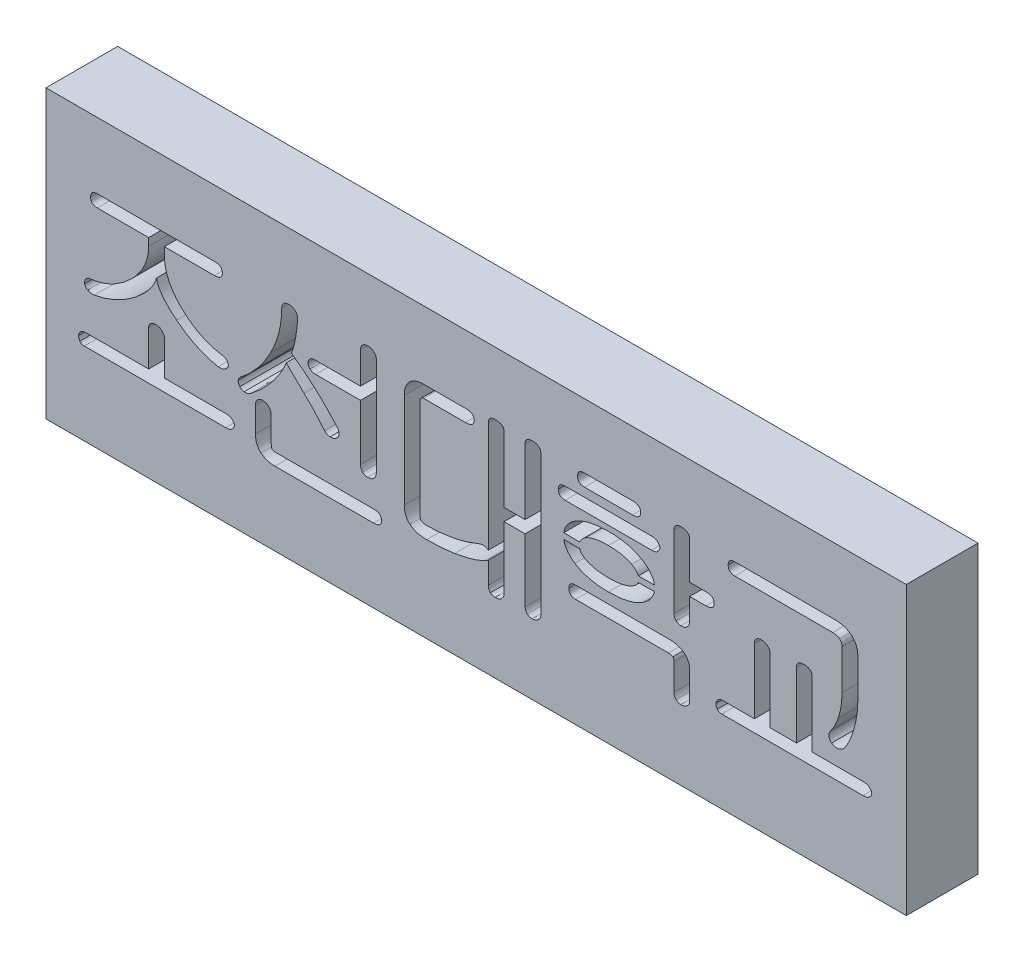
from build123d import *

# Parameters (mm, degrees)
SKETCH_1_W          = 60
SKETCH_1_H          = 20
EXTRUDE_1_DEPTH     = 5
CUT_EXTRUDE_1_DEPTH = 5
EXTRUDE_2_DEPTH     = 5


with BuildPart() as part:
    # 스케치1 → 보스-돌출1 (new body)
    with BuildSketch(Plane.XY):
        with Locations((30, -10)):
            Rectangle(SKETCH_1_W, SKETCH_1_H)
    extrude(amount=EXTRUDE_1_DEPTH)

    # 스케치2 → 컷-돌출1 (cut)
    # profile 1 of 14: a face of its own
    with BuildSketch(Plane.XY.offset(5)):
        with BuildLine():
            Line((11.743196013, -4.613258648), (3.588177984, -4.613258648))
            add(Edge.make_bspline(
                [(3.588177984, -4.613258648), (3.551138882, -4.613826649), (3.480826446, -4.614904904), (3.383328245, -4.636998521), (3.298127199, -4.667881596), (3.230315991, -4.717147552), (3.176232954, -4.777909236), (3.139896115, -4.853883321), (3.116844581, -4.942000588), (3.114368275, -5.005523138), (3.113072816, -5.038754441)],
                knots=[0, 0, 0, 0, 1.213778229, 2.304151591, 3.270502864, 4.169414572, 5.028575513, 5.916487207, 6.910027289, 8, 8, 8, 8], degree=3))
            add(Edge.make_bspline(
                [(3.113072816, -5.038754441), (3.112786656, -5.072624287), (3.112250556, -5.1360772), (3.134981766, -5.224533463), (3.168625743, -5.300844201), (3.21948276, -5.365097181), (3.289484028, -5.409925999), (3.371411055, -5.446211911), (3.469887047, -5.463004715), (3.539810119, -5.466317292), (3.576729667, -5.46806634)],
                knots=[0, 0, 0, 0, 1.111351727, 2.082043886, 2.98209018, 3.846045182, 4.735294455, 5.692779303, 6.781781998, 8, 8, 8, 8], degree=3))
            Line((3.576729667, -5.46806634), (7.158144931, -5.46806634))
            Line((7.158144931, -5.46806634), (7.158144931, -5.996596989))
            add(Edge.make_bspline(
                [(7.158144931, -5.996596989), (7.154282128, -6.110010454), (7.146575893, -6.336268604), (7.090153263, -6.672841822), (6.992772893, -7.002823588), (6.860969677, -7.327766974), (6.691340074, -7.647745156), (6.480857495, -7.959873996), (6.237816443, -8.271092652), (6.050196811, -8.46412458), (5.954163561, -8.562928119)],
                knots=[0, 0, 0, 0, 0.934621415, 1.864555616, 2.803577483, 3.76540004, 4.750360518, 5.782690533, 6.865068468, 8, 8, 8, 8], degree=3))
            add(Edge.make_bspline(
                [(5.954163561, -8.562928119), (5.852461416, -8.659805256), (5.652127798, -8.850634537), (5.332213368, -9.108030467), (4.998679363, -9.3304996), (4.657073789, -9.527388317), (4.302182471, -9.6897664), (3.937027685, -9.821212276), (3.560822425, -9.924890497), (3.30371968, -9.967012564), (3.174130508, -9.988243624)],
                knots=[0, 0, 0, 0, 1.059754881, 2.087512799, 3.093977114, 4.082890173, 5.060143393, 6.034941555, 7.00953879, 8, 8, 8, 8], degree=3))
            add(Edge.make_bspline(
                [(3.174130508, -9.988243624), (3.135157802, -9.989983572), (3.059884116, -9.993344189), (2.953267228, -10.02167216), (2.85925295, -10.072699692), (2.80990483, -10.121747266), (2.78488772, -10.146612013)],
                knots=[0, 0, 0, 0, 1.077771385, 2.081657489, 3.027493121, 4, 4, 4, 4], degree=3))
            add(Edge.make_bspline(
                [(2.78488772, -10.146612013), (2.767832453, -10.171431254), (2.734188211, -10.220391176), (2.704157484, -10.304119267), (2.689525737, -10.392349077), (2.694542093, -10.451872434), (2.697117287, -10.482429321)],
                knots=[0, 0, 0, 0, 1.010965901, 1.994291963, 2.970350526, 4, 4, 4, 4], degree=3))
            add(Edge.make_bspline(
                [(2.697117287, -10.482429321), (2.704675737, -10.510960748), (2.719645856, -10.567469541), (2.765953461, -10.642739553), (2.825937143, -10.710131667), (2.876833301, -10.74364965), (2.903186998, -10.761005042)],
                knots=[0, 0, 0, 0, 0.988368707, 1.957543962, 2.942429626, 4, 4, 4, 4], degree=3))
            add(Edge.make_bspline(
                [(2.903186998, -10.761005042), (2.932518346, -10.777078761), (2.994750755, -10.81118242), (3.106867564, -10.834604427), (3.235036724, -10.847296846), (3.326124823, -10.839537767), (3.374476061, -10.835419105)],
                knots=[0, 0, 0, 0, 0.822755861, 1.7456436, 2.803346158, 4, 4, 4, 4], degree=3))
            add(Edge.make_bspline(
                [(3.374476061, -10.835419105), (3.503326636, -10.809702635), (3.760385757, -10.758397836), (4.139567253, -10.652118912), (4.512352584, -10.522130551), (4.878547799, -10.368027446), (5.236933178, -10.187361674), (5.587720992, -9.982136408), (5.934643601, -9.756357965), (6.155565967, -9.58711927), (6.267084234, -9.501690138)],
                knots=[0, 0, 0, 0, 0.979673969, 1.954466462, 2.934094494, 3.922594533, 4.915410195, 5.925081107, 6.952612347, 8, 8, 8, 8], degree=3))
            add(Edge.make_bspline(
                [(6.267084234, -9.501690138), (6.365791959, -9.419898055), (6.555995838, -9.262289606), (6.819146389, -9.01970437), (7.047901458, -8.779449503), (7.245579813, -8.545344416), (7.410333996, -8.315964213), (7.538199268, -8.088852982), (7.640066279, -7.867842956), (7.679198511, -7.716459626), (7.698123897, -7.643246629)],
                knots=[0, 0, 0, 0, 1.288869495, 2.483574379, 3.596355165, 4.622356127, 5.562812011, 6.430618007, 7.241005209, 8, 8, 8, 8], degree=3))
            add(Edge.make_bspline(
                [(7.698123897, -7.643246629), (7.717222188, -7.717012302), (7.756631137, -7.869226326), (7.855119149, -8.092758832), (7.983867947, -8.318874313), (8.146364338, -8.546414116), (8.339502384, -8.777432124), (8.566626163, -9.009900702), (8.82387365, -9.247136731), (9.012448853, -9.398511613), (9.110083032, -9.476885451)],
                knots=[0, 0, 0, 0, 0.774578378, 1.598327329, 2.476838199, 3.419871113, 4.440289186, 5.539146788, 6.725901499, 8, 8, 8, 8], degree=3))
            add(Edge.make_bspline(
                [(9.110083032, -9.476885451), (9.224205262, -9.565375502), (9.449178263, -9.739818926), (9.799756311, -9.974883184), (10.155543541, -10.183438652), (10.516778597, -10.367023544), (10.882868957, -10.526049138), (11.254789317, -10.657501341), (11.630333233, -10.766425287), (11.885227822, -10.816295137), (12.01223147, -10.841143263)],
                knots=[0, 0, 0, 0, 1.06929483, 2.107936973, 3.123452199, 4.122001319, 5.107307742, 6.077225608, 7.041959409, 8, 8, 8, 8], degree=3))
            add(Edge.make_bspline(
                [(12.01223147, -10.841143263), (12.057395748, -10.843536253), (12.143433792, -10.848094903), (12.266226238, -10.837173926), (12.376391072, -10.809885071), (12.439544766, -10.775680642), (12.470164162, -10.759096989)],
                knots=[0, 0, 0, 0, 1.146332821, 2.183766394, 3.119418496, 4, 4, 4, 4], degree=3))
            add(Edge.make_bspline(
                [(12.470164162, -10.759096989), (12.502613905, -10.73634069), (12.562371479, -10.694434003), (12.636135169, -10.625320408), (12.690471163, -10.556788431), (12.705520331, -10.50595916), (12.712486878, -10.482429321)],
                knots=[0, 0, 0, 0, 1.261505007, 2.323114749, 3.223737823, 4, 4, 4, 4], degree=3))
            add(Edge.make_bspline(
                [(12.712486878, -10.482429321), (12.715805619, -10.457600242), (12.722751928, -10.40563159), (12.704556733, -10.324576054), (12.669383004, -10.240786843), (12.634001022, -10.188034863), (12.615176181, -10.159968383)],
                knots=[0, 0, 0, 0, 0.862110841, 1.804446199, 2.831864397, 4, 4, 4, 4], degree=3))
            add(Edge.make_bspline(
                [(12.615176181, -10.159968383), (12.593194347, -10.138392994), (12.545897178, -10.09197035), (12.448903943, -10.044382532), (12.329759124, -10.008017184), (12.241487141, -9.995207719), (12.193496494, -9.988243624)],
                knots=[0, 0, 0, 0, 0.790760166, 1.701437526, 2.750345271, 4, 4, 4, 4], degree=3))
            add(Edge.make_bspline(
                [(12.193496494, -9.988243624), (12.065142586, -9.965063064), (11.80912268, -9.91882618), (11.434682522, -9.809117526), (11.068473067, -9.67518698), (10.715400697, -9.505392747), (10.371836434, -9.308290116), (10.039496955, -9.079752112), (9.715456479, -8.82288546), (9.513759283, -8.630091649), (9.411555388, -8.532399273)],
                knots=[0, 0, 0, 0, 0.97985952, 1.954467509, 2.928723608, 3.908209786, 4.895610686, 5.903484976, 6.937655033, 8, 8, 8, 8], degree=3))
            add(Edge.make_bspline(
                [(9.411555388, -8.532399273), (9.319599386, -8.437199793), (9.140168225, -8.251439725), (8.903941095, -7.953570235), (8.703772184, -7.647344775), (8.541507194, -7.331837143), (8.413213978, -7.008772518), (8.32474778, -6.676978986), (8.265844248, -6.337690785), (8.260080275, -6.108146311), (8.257183393, -5.992780883)],
                knots=[0, 0, 0, 0, 1.107410592, 2.160859144, 3.176806917, 4.164950092, 5.125900117, 6.080309467, 7.035193855, 8, 8, 8, 8], degree=3))
            Line((8.257183393, -5.992780883), (8.257183393, -5.46806634))
            Line((8.257183393, -5.46806634), (11.743196013, -5.46806634))
            add(Edge.make_bspline(
                [(11.743196013, -5.46806634), (11.787132688, -5.466438088), (11.869110346, -5.463400073), (11.984705713, -5.445512046), (12.081953804, -5.411268963), (12.1644099, -5.365504966), (12.226174474, -5.302526506), (12.272867982, -5.227465463), (12.296219386, -5.137375125), (12.300184828, -5.073839583), (12.302255508, -5.040662494)],
                knots=[0, 0, 0, 0, 1.31566758, 2.454790823, 3.484303, 4.388648397, 5.250105247, 6.095641232, 7.005578923, 8, 8, 8, 8], degree=3))
            add(Edge.make_bspline(
                [(12.302255508, -5.040662494), (12.300365677, -5.006785237), (12.29681304, -4.943100405), (12.271785396, -4.853194669), (12.227562475, -4.77695399), (12.163005454, -4.716418062), (12.083136273, -4.666958658), (11.983897125, -4.637340183), (11.869528092, -4.614563116), (11.78722972, -4.613713327), (11.743196013, -4.613258648)],
                knots=[0, 0, 0, 0, 1.01215748, 1.902724232, 2.7635695, 3.61065729, 4.523672089, 5.545780795, 6.686871112, 8, 8, 8, 8], degree=3))
        make_face()
    # profile 2 of 14: a face of its own
    with BuildSketch(Plane.XY.offset(5)):
        with BuildLine():
            Line((7.158144931, -10.923189537), (7.158144931, -13.40556634))
            Line((7.158144931, -13.40556634), (2.771531349, -13.40556634))
            add(Edge.make_bspline(
                [(2.771531349, -13.40556634), (2.736387431, -13.406865969), (2.668473797, -13.409377428), (2.57266293, -13.433230005), (2.484606904, -13.469056544), (2.435626939, -13.506751188), (2.410909354, -13.525773672)],
                knots=[0, 0, 0, 0, 1.084904766, 2.096517139, 3.039413381, 4, 4, 4, 4], degree=3))
            add(Edge.make_bspline(
                [(2.410909354, -13.525773672), (2.375671901, -13.569003598), (2.306433193, -13.653946861), (2.284366099, -13.761213778), (2.273529546, -13.813889658)],
                knots=[0, 0, 0, 0, 1.017854134, 2, 2, 2, 2], degree=3))
            add(Edge.make_bspline(
                [(2.273529546, -13.813889658), (2.272357202, -13.841321324), (2.270045959, -13.895402024), (2.287002961, -13.974696165), (2.314947937, -14.051163941), (2.345635861, -14.096193541), (2.361299979, -14.119178119)],
                knots=[0, 0, 0, 0, 1.011024851, 1.993204861, 2.975666257, 4, 4, 4, 4], degree=3))
            add(Edge.make_bspline(
                [(2.361299979, -14.119178119), (2.380673388, -14.140677126), (2.419062158, -14.18327781), (2.494160241, -14.227047413), (2.579351683, -14.255494906), (2.640256503, -14.258691543), (2.672312599, -14.260374033)],
                knots=[0, 0, 0, 0, 0.977719996, 1.937370429, 2.914374059, 4, 4, 4, 4], degree=3))
            Line((2.672312599, -14.260374033), (12.533129907, -14.260374033))
            add(Edge.make_bspline(
                [(12.533129907, -14.260374033), (12.5797465, -14.259445263), (12.666131799, -14.257724159), (12.784969813, -14.231887073), (12.885708868, -14.194273871), (12.937819016, -14.152346006), (12.962441806, -14.132534489)],
                knots=[0, 0, 0, 0, 1.218287832, 2.257611584, 3.176696538, 4, 4, 4, 4], degree=3))
            add(Edge.make_bspline(
                [(12.962441806, -14.132534489), (12.989120581, -14.105094602), (13.038335813, -14.05447532), (13.097920211, -13.976749053), (13.133237245, -13.90058752), (13.139094311, -13.850413564), (13.141798777, -13.827246028)],
                knots=[0, 0, 0, 0, 1.266232053, 2.335860761, 3.231593268, 4, 4, 4, 4], degree=3))
            add(Edge.make_bspline(
                [(13.141798777, -13.827246028), (13.139208512, -13.804031066), (13.133569716, -13.753494008), (13.095580364, -13.677715363), (13.034438964, -13.600026863), (12.984036047, -13.549398278), (12.956717647, -13.521957566)],
                knots=[0, 0, 0, 0, 0.761622411, 1.657989263, 2.730629315, 4, 4, 4, 4], degree=3))
            add(Edge.make_bspline(
                [(12.956717647, -13.521957566), (12.930693924, -13.50352783), (12.876304024, -13.465009456), (12.77401876, -13.429458014), (12.654134889, -13.409900651), (12.567562872, -13.407067728), (12.52168159, -13.40556634)],
                knots=[0, 0, 0, 0, 0.830717826, 1.736210452, 2.800240873, 4, 4, 4, 4], degree=3))
            Line((12.52168159, -13.40556634), (8.257183393, -13.40556634))
            Line((8.257183393, -13.40556634), (8.257183393, -10.974706965))
            add(Edge.make_bspline(
                [(8.257183393, -10.974706965), (8.25440717, -10.94192002), (8.248776724, -10.87542495), (8.207698741, -10.778350596), (8.13856238, -10.688076823), (8.078870008, -10.635938018), (8.047297575, -10.608360811)],
                knots=[0, 0, 0, 0, 0.899975131, 1.825235853, 2.849725838, 4, 4, 4, 4], degree=3))
            add(Edge.make_bspline(
                [(8.047297575, -10.608360811), (8.024112219, -10.587181864), (7.977020055, -10.544164949), (7.882974896, -10.504621915), (7.774519581, -10.47995222), (7.695747163, -10.477825709), (7.654238681, -10.476705162)],
                knots=[0, 0, 0, 0, 0.878890165, 1.785128498, 2.832891584, 4, 4, 4, 4], degree=3))
            add(Edge.make_bspline(
                [(7.654238681, -10.476705162), (7.622378163, -10.476265038), (7.560030712, -10.475403764), (7.469577004, -10.492275823), (7.386989059, -10.527249438), (7.340064707, -10.562198862), (7.31651332, -10.579740018)],
                knots=[0, 0, 0, 0, 1.055051919, 2.064617945, 3.028629486, 4, 4, 4, 4], degree=3))
            add(Edge.make_bspline(
                [(7.31651332, -10.579740018), (7.292328782, -10.600878928), (7.244351403, -10.642814377), (7.194932591, -10.726022159), (7.162224725, -10.820296107), (7.159543962, -10.887905628), (7.158144931, -10.923189537)],
                knots=[0, 0, 0, 0, 0.977652047, 1.939469835, 2.924655023, 4, 4, 4, 4], degree=3))
        make_face()
    # profile 3 of 14: a face of its own
    with BuildSketch(Plane.XY.offset(5)):
        with BuildLine():
            add(Edge.make_bspline(
                [(16.438914162, -5.101720186), (16.437039574, -5.232838352), (16.433291435, -5.495002116), (16.392775603, -5.886143468), (16.331492725, -6.275257616), (16.248794385, -6.662709517), (16.136466179, -7.047721199), (16.000881821, -7.430313821), (15.843111804, -7.811992785), (15.719198927, -8.059913028), (15.656612479, -8.185133648)],
                knots=[0, 0, 0, 0, 0.97943627, 1.958330463, 2.935007086, 3.9221728, 4.916406073, 5.929508942, 6.954227496, 8, 8, 8, 8], degree=3))
            add(Edge.make_bspline(
                [(15.656612479, -8.185133648), (15.592556244, -8.304907802), (15.465145407, -8.543144177), (15.249509569, -8.88341962), (15.023216785, -9.211763314), (14.777551431, -9.522583138), (14.518579922, -9.820763997), (14.243163117, -10.103331228), (13.952843845, -10.37170266), (13.748196476, -10.53819024), (13.645524739, -10.621717182)],
                knots=[0, 0, 0, 0, 1.023695438, 2.036177928, 3.035137718, 4.028916882, 5.021295304, 6.011446996, 7.002341487, 8, 8, 8, 8], degree=3))
            add(Edge.make_bspline(
                [(13.645524739, -10.621717182), (13.613957317, -10.644051713), (13.553235177, -10.687013742), (13.48137623, -10.769197241), (13.428988576, -10.860666468), (13.41308963, -10.927704661), (13.405110075, -10.961350595)],
                knots=[0, 0, 0, 0, 1.080255455, 2.077946792, 3.035336848, 4, 4, 4, 4], degree=3))
            add(Edge.make_bspline(
                [(13.405110075, -10.961350595), (13.404440439, -10.991987292), (13.403127843, -11.052040146), (13.423727421, -11.140227543), (13.4598766, -11.22325904), (13.495714969, -11.272317217), (13.51386909, -11.297167903)],
                knots=[0, 0, 0, 0, 1.014062702, 1.987726026, 2.980671684, 4, 4, 4, 4], degree=3))
            add(Edge.make_bspline(
                [(13.51386909, -11.297167903), (13.558949785, -11.334750714), (13.647414217, -11.408501616), (13.75880592, -11.437499412), (13.813433393, -11.451720186)],
                knots=[0, 0, 0, 0, 1.019182391, 2, 2, 2, 2], degree=3))
            add(Edge.make_bspline(
                [(13.813433393, -11.451720186), (13.856764901, -11.452435133), (13.940110818, -11.453810296), (14.058413384, -11.434264831), (14.164880594, -11.40066041), (14.226121477, -11.364486194), (14.256101662, -11.346777278)],
                knots=[0, 0, 0, 0, 1.122608667, 2.159279728, 3.098884097, 4, 4, 4, 4], degree=3))
            add(Edge.make_bspline(
                [(14.256101662, -11.346777278), (14.413657092, -11.220319096), (14.724625738, -10.970727384), (15.154840623, -10.566511248), (15.551727335, -10.148541433), (15.788970229, -9.852563107), (15.906567407, -9.705851797)],
                knots=[0, 0, 0, 0, 1.03863429, 2.049962352, 3.033400239, 4, 4, 4, 4], degree=3))
            add(Edge.make_bspline(
                [(15.906567407, -9.705851797), (15.998430588, -9.578423299), (16.176186045, -9.331848875), (16.408469528, -8.957645379), (16.604897944, -8.596684291), (16.707845253, -8.353895113), (16.757558994, -8.236651076)],
                knots=[0, 0, 0, 0, 1.106997821, 2.142043213, 3.102783913, 4, 4, 4, 4], degree=3))
            add(Edge.make_bspline(
                [(16.757558994, -8.236651076), (16.849006735, -8.327742233), (17.03891619, -8.516911171), (17.337415058, -8.808627679), (17.656574587, -9.121056723), (17.878076104, -9.334567688), (17.99206921, -9.444448552)],
                knots=[0, 0, 0, 0, 0.896816313, 1.862417771, 2.899918878, 4, 4, 4, 4], degree=3))
            add(Edge.make_bspline(
                [(17.99206921, -9.444448552), (18.11897311, -9.566868023), (18.372815587, -9.811740418), (18.735948209, -10.196346633), (19.088268012, -10.59063145), (19.311496951, -10.863220325), (19.423108873, -10.999511653)],
                knots=[0, 0, 0, 0, 1.000382647, 2.001038656, 3.000542132, 4, 4, 4, 4], degree=3))
            add(Edge.make_bspline(
                [(19.423108873, -10.999511653), (19.448051506, -11.025719371), (19.497109013, -11.077265065), (19.590803498, -11.130367895), (19.692634178, -11.168330174), (19.765580019, -11.176570722), (19.802811397, -11.180776677)],
                knots=[0, 0, 0, 0, 1.000236241, 1.967278117, 2.96250375, 4, 4, 4, 4], degree=3))
            add(Edge.make_bspline(
                [(19.802811397, -11.180776677), (19.844296531, -11.179497955), (19.924135815, -11.177037018), (20.036935873, -11.153218554), (20.140244312, -11.118113095), (20.199069426, -11.079674451), (20.228307191, -11.060569345)],
                knots=[0, 0, 0, 0, 1.106584405, 2.129652202, 3.07038362, 4, 4, 4, 4], degree=3))
            add(Edge.make_bspline(
                [(20.228307191, -11.060569345), (20.258121443, -11.031879048), (20.313702665, -10.978393159), (20.383110022, -10.895565231), (20.425111284, -10.811858603), (20.436662763, -10.756225), (20.442009114, -10.730476196)],
                knots=[0, 0, 0, 0, 1.2369905, 2.306059613, 3.215996511, 4, 4, 4, 4], degree=3))
            add(Edge.make_bspline(
                [(20.442009114, -10.730476196), (20.442015002, -10.697923188), (20.442026935, -10.631953875), (20.417923095, -10.533073828), (20.37263455, -10.436069442), (20.330437957, -10.37623485), (20.308445412, -10.345049513)],
                knots=[0, 0, 0, 0, 0.934884219, 1.894561335, 2.902661304, 4, 4, 4, 4], degree=3))
            add(Edge.make_bspline(
                [(20.308445412, -10.345049513), (20.175362486, -10.19581817), (19.912635825, -9.901211989), (19.503915717, -9.482604595), (19.097241785, -9.081683015), (18.817322708, -8.830288049), (18.678968248, -8.706032085)],
                knots=[0, 0, 0, 0, 1.037402952, 2.04799685, 3.035191373, 4, 4, 4, 4], degree=3))
            add(Edge.make_bspline(
                [(18.678968248, -8.706032085), (18.553072388, -8.594586899), (18.302654737, -8.372912879), (17.916982962, -8.055828134), (17.52330571, -7.756147318), (17.255463815, -7.566182247), (17.121997095, -7.471521869)],
                knots=[0, 0, 0, 0, 1.014688041, 2.018301423, 3.012511427, 4, 4, 4, 4], degree=3))
            add(Edge.make_bspline(
                [(17.121997095, -7.471521869), (17.155537109, -7.377749971), (17.222716223, -7.189929152), (17.3036011, -6.901611574), (17.37124767, -6.608690161), (17.404735635, -6.41083598), (17.421561397, -6.311425715)],
                knots=[0, 0, 0, 0, 0.995506885, 1.993954712, 2.992078447, 4, 4, 4, 4], degree=3))
            add(Edge.make_bspline(
                [(17.421561397, -6.311425715), (17.439708038, -6.206629801), (17.47534247, -6.000842792), (17.511387275, -5.693892825), (17.532839816, -5.395235179), (17.536268046, -5.198428051), (17.537952623, -5.101720186)],
                knots=[0, 0, 0, 0, 1.048642125, 2.059211256, 3.046327555, 4, 4, 4, 4], degree=3))
            add(Edge.make_bspline(
                [(17.537952623, -5.101720186), (17.535015057, -5.069622283), (17.528944191, -5.003287769), (17.48915893, -4.905640754), (17.418249625, -4.814905405), (17.359464194, -4.760575573), (17.328066806, -4.731557927)],
                knots=[0, 0, 0, 0, 0.877593539, 1.813661754, 2.832273418, 4, 4, 4, 4], degree=3))
            add(Edge.make_bspline(
                [(17.328066806, -4.731557927), (17.304604022, -4.713236627), (17.254968268, -4.674477733), (17.161057234, -4.637406793), (17.049731954, -4.617409888), (16.970084386, -4.614707646), (16.9273757, -4.613258648)],
                knots=[0, 0, 0, 0, 0.833213073, 1.762670615, 2.800297373, 4, 4, 4, 4], degree=3))
            add(Edge.make_bspline(
                [(16.9273757, -4.613258648), (16.894765307, -4.614582385), (16.831233086, -4.617161317), (16.741204596, -4.641255729), (16.657441366, -4.676860015), (16.611157864, -4.714449066), (16.587742287, -4.73346598)],
                knots=[0, 0, 0, 0, 1.060439937, 2.065970274, 3.021542859, 4, 4, 4, 4], degree=3))
            add(Edge.make_bspline(
                [(16.587742287, -4.73346598), (16.564791995, -4.757289039), (16.519219536, -4.804594555), (16.473862511, -4.893997063), (16.443425638, -4.993512155), (16.440462812, -5.064575723), (16.438914162, -5.101720186)],
                knots=[0, 0, 0, 0, 0.966578454, 1.919337543, 2.912451312, 4, 4, 4, 4], degree=3))
        make_face()
    # profile 4 of 14: a face of its own
    with BuildSketch(Plane.XY.offset(5)):
        with BuildLine():
            Line((23.033144931, -11.781813335), (23.033144931, -4.830776677))
            add(Edge.make_bspline(
                [(23.033144931, -4.830776677), (23.030521229, -4.799801186), (23.025162453, -4.736535358), (22.980494567, -4.64531101), (22.91088102, -4.559358001), (22.8498017, -4.510977413), (22.817534955, -4.485419105)],
                knots=[0, 0, 0, 0, 0.87701776, 1.791263171, 2.833177144, 4, 4, 4, 4], degree=3))
            add(Edge.make_bspline(
                [(22.817534955, -4.485419105), (22.794792235, -4.466938552), (22.74687818, -4.428003976), (22.653888346, -4.393762182), (22.544398053, -4.372844464), (22.465311207, -4.3703669), (22.422568008, -4.369027879)],
                knots=[0, 0, 0, 0, 0.830200477, 1.749055086, 2.783456524, 4, 4, 4, 4], degree=3))
            add(Edge.make_bspline(
                [(22.422568008, -4.369027879), (22.389982086, -4.370404205), (22.326497541, -4.373085592), (22.235870189, -4.396521573), (22.153103668, -4.434925672), (22.106437628, -4.47231326), (22.082934595, -4.491143263)],
                knots=[0, 0, 0, 0, 1.058130854, 2.061471671, 3.023673427, 4, 4, 4, 4], degree=3))
            add(Edge.make_bspline(
                [(22.082934595, -4.491143263), (22.060040214, -4.515000403), (22.014968233, -4.56196776), (21.969412707, -4.649123995), (21.938939124, -4.744152047), (21.935747477, -4.811442981), (21.93410647, -4.8460411)],
                knots=[0, 0, 0, 0, 0.998185759, 1.965120137, 2.953751867, 4, 4, 4, 4], degree=3))
            Line((21.93410647, -4.8460411), (21.93410647, -7.05556634))
            Line((21.93410647, -7.05556634), (18.77246284, -7.05556634))
            add(Edge.make_bspline(
                [(18.77246284, -7.05556634), (18.734742739, -7.056630959), (18.66283313, -7.058660547), (18.561749726, -7.084966339), (18.471602065, -7.123689575), (18.422532674, -7.163765333), (18.398484474, -7.183405883)],
                knots=[0, 0, 0, 0, 1.116273672, 2.128064362, 3.082591389, 4, 4, 4, 4], degree=3))
            add(Edge.make_bspline(
                [(18.398484474, -7.183405883), (18.379008519, -7.202952816), (18.340345937, -7.241756298), (18.300303336, -7.314868939), (18.274174757, -7.395970212), (18.271840596, -7.453500519), (18.270644931, -7.482970186)],
                knots=[0, 0, 0, 0, 0.982221796, 1.949852046, 2.949819985, 4, 4, 4, 4], degree=3))
            add(Edge.make_bspline(
                [(18.270644931, -7.482970186), (18.272584204, -7.511164965), (18.276420762, -7.566944049), (18.303801603, -7.646254503), (18.349505723, -7.71770859), (18.390561375, -7.756634647), (18.411840845, -7.776810331)],
                knots=[0, 0, 0, 0, 1.004752164, 1.987749384, 2.957034598, 4, 4, 4, 4], degree=3))
            add(Edge.make_bspline(
                [(18.411840845, -7.776810331), (18.437695021, -7.797928964), (18.489045099, -7.839873579), (18.583651705, -7.878866208), (18.686766286, -7.907710927), (18.760780439, -7.909464408), (18.79917558, -7.910374033)],
                knots=[0, 0, 0, 0, 0.950855505, 1.888534546, 2.904668739, 4, 4, 4, 4], degree=3))
            Line((18.79917558, -7.910374033), (21.93410647, -7.910374033))
            Line((21.93410647, -7.910374033), (21.93410647, -11.779905283))
            add(Edge.make_bspline(
                [(21.93410647, -11.779905283), (21.935891395, -11.81826171), (21.939330132, -11.892157033), (21.967009968, -11.996787164), (22.010253907, -12.091831869), (22.05486544, -12.143345804), (22.077210436, -12.169148071)],
                knots=[0, 0, 0, 0, 1.081745412, 2.084029534, 3.040329948, 4, 4, 4, 4], degree=3))
            add(Edge.make_bspline(
                [(22.077210436, -12.169148071), (22.099964573, -12.189893436), (22.145706031, -12.231596761), (22.229164592, -12.27580782), (22.323230354, -12.300560099), (22.388712213, -12.304493968), (22.422568008, -12.306527879)],
                knots=[0, 0, 0, 0, 0.965404326, 1.940702037, 2.935290319, 4, 4, 4, 4], degree=3))
            add(Edge.make_bspline(
                [(22.422568008, -12.306527879), (22.467339064, -12.305768226), (22.551451945, -12.304341042), (22.665889979, -12.275794242), (22.765264053, -12.238929608), (22.813502433, -12.194332527), (22.836615484, -12.172964177)],
                knots=[0, 0, 0, 0, 1.198138482, 2.250982859, 3.161971825, 4, 4, 4, 4], degree=3))
            add(Edge.make_bspline(
                [(22.836615484, -12.172964177), (22.866598585, -12.14288013), (22.923716376, -12.085570037), (22.984591773, -11.986126581), (23.027232666, -11.885655521), (23.031202999, -11.815921156), (23.033144931, -11.781813335)],
                knots=[0, 0, 0, 0, 1.128609039, 2.149999564, 3.095145075, 4, 4, 4, 4], degree=3))
        make_face()
    # profile 5 of 14: a face of its own
    with BuildSketch(Plane.XY.offset(5)):
        with BuildLine():
            add(Edge.make_bspline(
                [(15.706221854, -11.886756244), (15.704083888, -11.850210646), (15.699740045, -11.775958638), (15.661255364, -11.667780281), (15.598645064, -11.564122685), (15.541509998, -11.504119653), (15.51160046, -11.472708768)],
                knots=[0, 0, 0, 0, 0.930526552, 1.890609816, 2.895758926, 4, 4, 4, 4], degree=3))
            add(Edge.make_bspline(
                [(15.51160046, -11.472708768), (15.487858853, -11.45019591), (15.438962285, -11.403829988), (15.339984589, -11.3610681), (15.224305823, -11.334504519), (15.140350981, -11.331307316), (15.095644931, -11.329604802)],
                knots=[0, 0, 0, 0, 0.862219525, 1.775767607, 2.815593677, 4, 4, 4, 4], degree=3))
            add(Edge.make_bspline(
                [(15.095644931, -11.329604802), (15.061700024, -11.331335758), (14.996484802, -11.334661284), (14.904034093, -11.363269664), (14.819233153, -11.406604222), (14.773509868, -11.450443256), (14.750287359, -11.472708768)],
                knots=[0, 0, 0, 0, 1.057464038, 2.031608183, 3.000268724, 4, 4, 4, 4], degree=3))
            add(Edge.make_bspline(
                [(14.750287359, -11.472708768), (14.727953178, -11.499167076), (14.683315244, -11.552047647), (14.639354464, -11.650030871), (14.612398634, -11.759986579), (14.608972921, -11.838243869), (14.607183393, -11.879124033)],
                knots=[0, 0, 0, 0, 0.937684764, 1.874092027, 2.889464948, 4, 4, 4, 4], degree=3))
            Line((14.607183393, -11.879124033), (14.607183393, -13.598279682))
            add(Edge.make_bspline(
                [(14.607183393, -13.598279682), (14.60800442, -13.649232545), (14.609591264, -13.747711799), (14.629749613, -13.890720151), (14.660231034, -14.024779337), (14.700818676, -14.151101244), (14.757947657, -14.26672009), (14.824238882, -14.374597622), (14.904799208, -14.472571573), (14.967090893, -14.52948466), (14.998334234, -14.558030283)],
                knots=[0, 0, 0, 0, 1.140942192, 2.205158444, 3.228510247, 4.220006747, 5.169755849, 6.110911703, 7.052499082, 8, 8, 8, 8], degree=3))
            add(Edge.make_bspline(
                [(14.998334234, -14.558030283), (15.061345074, -14.606924517), (15.189696495, -14.706520785), (15.423773367, -14.800737985), (15.685799182, -14.862396152), (15.87180808, -14.868004467), (15.969533152, -14.870950956)],
                knots=[0, 0, 0, 0, 0.914397999, 1.862604627, 2.877058463, 4, 4, 4, 4], degree=3))
            Line((15.969533152, -14.870950956), (22.842339643, -14.870950956))
            add(Edge.make_bspline(
                [(22.842339643, -14.870950956), (22.885631944, -14.869230694), (22.967583417, -14.865974272), (23.082654688, -14.848869975), (23.180326829, -14.81414509), (23.261050304, -14.766214844), (23.324144215, -14.703387868), (23.369568406, -14.626818077), (23.39374236, -14.53589675), (23.397507351, -14.471665642), (23.399491085, -14.437822951)],
                knots=[0, 0, 0, 0, 1.292319837, 2.446335976, 3.454528254, 4.365575023, 5.224145591, 6.08313528, 6.990024257, 8, 8, 8, 8], degree=3))
            add(Edge.make_bspline(
                [(23.399491085, -14.437822951), (23.397511671, -14.404612788), (23.393757441, -14.341625173), (23.369553973, -14.252544744), (23.324054269, -14.177841571), (23.260861052, -14.117049895), (23.180170293, -14.070797124), (23.082066487, -14.039389523), (22.967926837, -14.017874168), (22.885702585, -14.016740913), (22.842339643, -14.016143263)],
                knots=[0, 0, 0, 0, 1.001154286, 1.89882603, 2.750087126, 3.603933028, 4.514401734, 5.52650191, 6.695541121, 8, 8, 8, 8], degree=3))
            Line((22.842339643, -14.016143263), (16.076384114, -14.016143263))
            add(Edge.make_bspline(
                [(16.076384114, -14.016143263), (16.040011568, -14.015213309), (15.973886319, -14.013522653), (15.884403744, -13.997829633), (15.810578892, -13.976085433), (15.774314547, -13.94726835), (15.757739282, -13.934096989)],
                knots=[0, 0, 0, 0, 1.297233898, 2.358369767, 3.249663631, 4, 4, 4, 4], degree=3))
            add(Edge.make_bspline(
                [(15.757739282, -13.934096989), (15.749249278, -13.919131028), (15.726609268, -13.879221799), (15.718556183, -13.793362379), (15.707435427, -13.675690907), (15.706662292, -13.585044833), (15.706221854, -13.533405883)],
                knots=[0, 0, 0, 0, 0.502056024, 1.338816065, 2.483985693, 4, 4, 4, 4], degree=3))
            Line((15.706221854, -13.533405883), (15.706221854, -11.886756244))
        make_face()
    # profile 6 of 14: a face of its own
    with BuildSketch(Plane.XY.offset(5)):
        with BuildLine():
            Line((29.245765123, -4.735374033), (26.343616686, -4.735374033))
            add(Edge.make_bspline(
                [(26.343616686, -4.735374033), (26.292051347, -4.736431482), (26.191167217, -4.738500311), (26.044300478, -4.755825911), (25.905705356, -4.784411947), (25.775241364, -4.824417), (25.653393883, -4.876054872), (25.538834992, -4.937392057), (25.4334659, -5.011541819), (25.371118489, -5.07041141), (25.339980869, -5.099812133)],
                knots=[0, 0, 0, 0, 1.128576889, 2.207985065, 3.232001574, 4.222920658, 5.190077986, 6.124613619, 7.063392223, 8, 8, 8, 8], degree=3))
            add(Edge.make_bspline(
                [(25.339980869, -5.099812133), (25.285298727, -5.163159257), (25.174996615, -5.290939942), (25.065312716, -5.526892562), (24.999343145, -5.791985758), (24.991230767, -5.978998719), (24.986991085, -6.07673521)],
                knots=[0, 0, 0, 0, 0.939362356, 1.894835285, 2.899801317, 4, 4, 4, 4], degree=3))
            Line((24.986991085, -6.07673521), (24.986991085, -12.712943143))
            add(Edge.make_bspline(
                [(24.986991085, -12.712943143), (24.987853337, -12.763261602), (24.989540833, -12.861738796), (25.009605158, -13.004689683), (25.039080972, -13.139359455), (25.08349017, -13.263943631), (25.139461771, -13.379543203), (25.205999687, -13.487343614), (25.287109057, -13.585994482), (25.350055269, -13.643532163), (25.381958032, -13.672693744)],
                knots=[0, 0, 0, 0, 1.125127389, 2.20196306, 3.223885986, 4.205162212, 5.153585206, 6.093426951, 7.033699619, 8, 8, 8, 8], degree=3))
            add(Edge.make_bspline(
                [(25.381958032, -13.672693744), (25.416321788, -13.700282192), (25.48653826, -13.756654478), (25.605180532, -13.825762318), (25.73447299, -13.886358087), (25.875882755, -13.932415808), (26.027344973, -13.97147162), (26.19082884, -13.997760231), (26.365600632, -14.01250983), (26.486056197, -14.014912249), (26.547778345, -14.016143263)],
                knots=[0, 0, 0, 0, 0.851242608, 1.739369043, 2.647459655, 3.608256233, 4.610671506, 5.670320794, 6.806258539, 8, 8, 8, 8], degree=3))
            add(Edge.make_bspline(
                [(26.547778345, -14.016143263), (26.725891959, -14.014080157), (27.07211795, -14.010069788), (27.57691233, -13.985739206), (28.051392974, -13.943500031), (28.356147117, -13.898579773), (28.503532551, -13.876855403)],
                knots=[0, 0, 0, 0, 1.089009988, 2.116871091, 3.089279741, 4, 4, 4, 4], degree=3))
            add(Edge.make_bspline(
                [(28.503532551, -13.876855403), (28.698094124, -13.843317955), (29.07637188, -13.778112528), (29.619211292, -13.637926864), (30.126136867, -13.478724032), (30.441291186, -13.339701132), (30.594758513, -13.272002638)],
                knots=[0, 0, 0, 0, 1.084461813, 2.108472785, 3.078903228, 4, 4, 4, 4], degree=3))
            add(Edge.make_bspline(
                [(30.594758513, -13.272002638), (30.636460462, -13.248450824), (30.713510044, -13.204935893), (30.814085851, -13.136611303), (30.885822637, -13.065345335), (30.916731631, -13.01435674), (30.93057582, -12.991518864)],
                knots=[0, 0, 0, 0, 1.294706464, 2.392132585, 3.279833555, 4, 4, 4, 4], degree=3))
            add(Edge.make_bspline(
                [(30.93057582, -12.991518864), (30.944090873, -12.962092216), (30.970053347, -12.905563497), (30.984755238, -12.815972876), (30.982279095, -12.728934638), (30.96438689, -12.675145257), (30.955380508, -12.648069345)],
                knots=[0, 0, 0, 0, 1.089784515, 2.093480802, 3.04031718, 4, 4, 4, 4], degree=3))
            add(Edge.make_bspline(
                [(30.955380508, -12.648069345), (30.944487719, -12.624413484), (30.921100798, -12.573624128), (30.85517239, -12.50699234), (30.761747163, -12.449994233), (30.689324515, -12.417581142), (30.650092046, -12.40002247)],
                knots=[0, 0, 0, 0, 0.767754852, 1.648376916, 2.726089386, 4, 4, 4, 4], degree=3))
            add(Edge.make_bspline(
                [(30.650092046, -12.40002247), (30.613362838, -12.392182767), (30.53793721, -12.376083466), (30.418764946, -12.380112953), (30.293534183, -12.40290221), (30.212070863, -12.434785536), (30.16926272, -12.451539898)],
                knots=[0, 0, 0, 0, 0.912173687, 1.873203302, 2.882390022, 4, 4, 4, 4], degree=3))
            add(Edge.make_bspline(
                [(30.16926272, -12.451539898), (30.040735165, -12.504597627), (29.77887444, -12.612696901), (29.366193964, -12.749041004), (28.929731925, -12.869143536), (28.628525343, -12.935023722), (28.474911758, -12.96862223)],
                knots=[0, 0, 0, 0, 0.940054802, 1.915258028, 2.936793852, 4, 4, 4, 4], degree=3))
            add(Edge.make_bspline(
                [(28.474911758, -12.96862223), (28.31488825, -12.998189947), (27.995339639, -13.057233291), (27.51129317, -13.117417018), (27.025402308, -13.155119323), (26.70049124, -13.15926521), (26.53823808, -13.161335571)],
                knots=[0, 0, 0, 0, 1.001609394, 2.000099207, 3.00129526, 4, 4, 4, 4], degree=3))
            add(Edge.make_bspline(
                [(26.53823808, -13.161335571), (26.492912838, -13.160190109), (26.409212659, -13.158074834), (26.296736798, -13.135542171), (26.204533867, -13.10144466), (26.161445261, -13.061604486), (26.14136308, -13.043036292)],
                knots=[0, 0, 0, 0, 1.276676927, 2.357584446, 3.234524188, 4, 4, 4, 4], degree=3))
            add(Edge.make_bspline(
                [(26.14136308, -13.043036292), (26.132222922, -13.02487914), (26.108754489, -12.978258512), (26.09717873, -12.880971646), (26.087761974, -12.747620439), (26.086654745, -12.644972148), (26.086029546, -12.587011653)],
                knots=[0, 0, 0, 0, 0.523565615, 1.344316421, 2.500464727, 4, 4, 4, 4], degree=3))
            Line((26.086029546, -12.587011653), (26.086029546, -6.011861412))
            add(Edge.make_bspline(
                [(26.086029546, -6.011861412), (26.086755293, -5.97173453), (26.088048156, -5.900251584), (26.096631875, -5.806489317), (26.110777907, -5.736541973), (26.131123712, -5.703096086), (26.139455027, -5.689400475)],
                knots=[0, 0, 0, 0, 1.453309191, 2.588958226, 3.42219864, 4, 4, 4, 4], degree=3))
            add(Edge.make_bspline(
                [(26.139455027, -5.689400475), (26.168629628, -5.66047747), (26.224585851, -5.605003803), (26.302506434, -5.594979521), (26.33980058, -5.590181725)],
                knots=[0, 0, 0, 0, 1.042765214, 2, 2, 2, 2], degree=3))
            Line((26.33980058, -5.590181725), (29.24385707, -5.590181725))
            add(Edge.make_bspline(
                [(29.24385707, -5.590181725), (29.290962072, -5.588486787), (29.379868858, -5.585287733), (29.50556164, -5.567852389), (29.6127363, -5.533181398), (29.704027586, -5.48827146), (29.774985247, -5.425499742), (29.825220501, -5.348664914), (29.859435789, -5.259489844), (29.866156474, -5.19490657), (29.869698417, -5.160869826)],
                knots=[0, 0, 0, 0, 1.325363505, 2.501513739, 3.553494489, 4.481407515, 5.342825105, 6.181096742, 7.041399709, 8, 8, 8, 8], degree=3))
            add(Edge.make_bspline(
                [(29.869698417, -5.160869826), (29.867957302, -5.127617085), (29.86460359, -5.063566071), (29.836369746, -4.973123968), (29.784238216, -4.898592156), (29.714293321, -4.837257685), (29.624602928, -4.788947336), (29.514341671, -4.759332946), (29.386604338, -4.736694529), (29.29486698, -4.735834407), (29.245765123, -4.735374033)],
                knots=[0, 0, 0, 0, 0.930307611, 1.791946938, 2.61190707, 3.44453291, 4.376883659, 5.436146459, 6.627713147, 8, 8, 8, 8], degree=3))
        make_face()
    # profile 7 of 14: a face of its own
    with BuildSketch(Plane.XY.offset(5)):
        with BuildLine():
            Line((33.412952623, -4.817420307), (33.412952623, -9.375758648))
            Line((33.412952623, -9.375758648), (31.947568008, -9.375758648))
            Line((31.947568008, -9.375758648), (31.947568008, -4.817420307))
            add(Edge.make_bspline(
                [(31.947568008, -4.817420307), (31.945931098, -4.782222435), (31.94280363, -4.714973614), (31.91382379, -4.62109903), (31.864493621, -4.540791731), (31.793206639, -4.477836321), (31.704829474, -4.426339882), (31.596344069, -4.394293856), (31.470133183, -4.372838339), (31.379716113, -4.370357314), (31.331266926, -4.369027879)],
                knots=[0, 0, 0, 0, 0.972421386, 1.857901875, 2.688459155, 3.548360788, 4.463457245, 5.499177885, 6.659956618, 8, 8, 8, 8], degree=3))
            add(Edge.make_bspline(
                [(31.331266926, -4.369027879), (31.293644195, -4.370505291), (31.222206281, -4.373310597), (31.122606344, -4.393607484), (31.03714148, -4.428348748), (30.966834778, -4.477984429), (30.914000156, -4.544141962), (30.874807735, -4.622529181), (30.852350584, -4.715720918), (30.849848411, -4.782317866), (30.848529546, -4.817420307)],
                knots=[0, 0, 0, 0, 1.196798901, 2.272477656, 3.215893637, 4.114618633, 4.977538176, 5.882621083, 6.883955336, 8, 8, 8, 8], degree=3))
            Line((30.848529546, -4.817420307), (30.848529546, -14.617179922))
            add(Edge.make_bspline(
                [(30.848529546, -14.617179922), (30.850173474, -14.6536728), (30.853372305, -14.724682315), (30.883807143, -14.825333109), (30.929119556, -14.918149768), (30.974432896, -14.969164957), (30.997357671, -14.994974393)],
                knots=[0, 0, 0, 0, 1.049169431, 2.041521951, 3.009173265, 4, 4, 4, 4], degree=3))
            add(Edge.make_bspline(
                [(30.997357671, -14.994974393), (31.020767363, -15.014013631), (31.067039232, -15.051646809), (31.149745342, -15.086439085), (31.23754731, -15.111576969), (31.299264152, -15.113950796), (31.331266926, -15.115181725)],
                knots=[0, 0, 0, 0, 0.993554198, 1.963870744, 2.94418145, 4, 4, 4, 4], degree=3))
            add(Edge.make_bspline(
                [(31.331266926, -15.115181725), (31.374030067, -15.113943633), (31.455152997, -15.111594936), (31.567472437, -15.08835762), (31.66516287, -15.053951936), (31.716786262, -15.015357528), (31.741498296, -14.996882446)],
                knots=[0, 0, 0, 0, 1.176800063, 2.232424149, 3.153864279, 4, 4, 4, 4], degree=3))
            add(Edge.make_bspline(
                [(31.741498296, -14.996882446), (31.772416874, -14.966633359), (31.830494275, -14.909813525), (31.897652102, -14.815215333), (31.939019469, -14.71705758), (31.944761626, -14.649968547), (31.947568008, -14.617179922)],
                knots=[0, 0, 0, 0, 1.166277282, 2.190733225, 3.115751584, 4, 4, 4, 4], degree=3))
            Line((31.947568008, -14.617179922), (31.947568008, -10.23056634))
            Line((31.947568008, -10.23056634), (33.412952623, -10.23056634))
            Line((33.412952623, -10.23056634), (33.412952623, -14.641984609))
            add(Edge.make_bspline(
                [(33.412952623, -14.641984609), (33.414437275, -14.677260053), (33.41733321, -14.746067705), (33.450033044, -14.842259292), (33.497246745, -14.930430098), (33.545088233, -14.975748579), (33.56941296, -14.998790499)],
                knots=[0, 0, 0, 0, 1.048564977, 2.0453122, 3.006150304, 4, 4, 4, 4], degree=3))
            add(Edge.make_bspline(
                [(33.56941296, -14.998790499), (33.592965044, -15.016923636), (33.639348256, -15.052634834), (33.72049828, -15.089807787), (33.808785915, -15.110446224), (33.870142423, -15.113582997), (33.901414162, -15.115181725)],
                knots=[0, 0, 0, 0, 0.990427911, 1.950537654, 2.95544495, 4, 4, 4, 4], degree=3))
            add(Edge.make_bspline(
                [(33.901414162, -15.115181725), (33.944875809, -15.114262411), (34.025639551, -15.112554073), (34.136720074, -15.086340077), (34.232171717, -15.049216225), (34.279545343, -15.00600965), (34.302105268, -14.985434129)],
                knots=[0, 0, 0, 0, 1.202385652, 2.234364567, 3.159181918, 4, 4, 4, 4], degree=3))
            add(Edge.make_bspline(
                [(34.302105268, -14.985434129), (34.333581821, -14.957779192), (34.392710697, -14.905829245), (34.462462721, -14.817495961), (34.503009241, -14.723414637), (34.509067302, -14.659483246), (34.511991085, -14.628628239)],
                knots=[0, 0, 0, 0, 1.174366591, 2.206054005, 3.134193467, 4, 4, 4, 4], degree=3))
            Line((34.511991085, -14.628628239), (34.511991085, -4.817420307))
            add(Edge.make_bspline(
                [(34.511991085, -4.817420307), (34.510346288, -4.782231203), (34.50720375, -4.714999134), (34.478327092, -4.621009847), (34.428880407, -4.541508659), (34.359512165, -4.477165875), (34.27152913, -4.426913331), (34.164106397, -4.393888019), (34.038963566, -4.37303948), (33.949211848, -4.370421889), (33.901414162, -4.369027879)],
                knots=[0, 0, 0, 0, 0.978196174, 1.868935147, 2.704424746, 3.5564603, 4.476991117, 5.502014125, 6.669686219, 8, 8, 8, 8], degree=3))
            add(Edge.make_bspline(
                [(33.901414162, -4.369027879), (33.863134459, -4.370430372), (33.791019961, -4.373072506), (33.690436023, -4.39407843), (33.603750854, -4.427703937), (33.533297636, -4.478647937), (33.478198963, -4.543423929), (33.439353743, -4.622635132), (33.416737351, -4.715689623), (33.414258955, -4.782307064), (33.412952623, -4.817420307)],
                knots=[0, 0, 0, 0, 1.209154943, 2.277907017, 3.233827933, 4.126765717, 4.997000891, 5.896255645, 6.891141947, 8, 8, 8, 8], degree=3))
        make_face()
    # profile 8 of 14: a face of its own
    with BuildSketch(Plane.XY.offset(5)):
        with BuildLine():
            Line((40.873439402, -4.491143263), (37.553427383, -4.491143263))
            add(Edge.make_bspline(
                [(37.553427383, -4.491143263), (37.515741285, -4.491612342), (37.445396255, -4.492487927), (37.347943988, -4.515078648), (37.263931055, -4.545988712), (37.195072795, -4.593560829), (37.139449792, -4.653287973), (37.103702628, -4.729389793), (37.079915103, -4.816612281), (37.077624309, -4.879566439), (37.076414162, -4.912822951)],
                knots=[0, 0, 0, 0, 1.237414559, 2.309763231, 3.278278247, 4.167191465, 5.04217569, 5.932075494, 6.907586748, 8, 8, 8, 8], degree=3))
            add(Edge.make_bspline(
                [(37.076414162, -4.912822951), (37.077627172, -4.946711322), (37.079925132, -5.010910375), (37.103718541, -5.100005085), (37.139380879, -5.177931372), (37.194927516, -5.239678817), (37.26378015, -5.288898449), (37.347270469, -5.323131618), (37.445801879, -5.3413772), (37.515825817, -5.344353004), (37.553427383, -5.345950956)],
                knots=[0, 0, 0, 0, 1.100584403, 2.084977019, 2.983282269, 3.863749791, 4.754385271, 5.719644564, 6.775491106, 8, 8, 8, 8], degree=3))
            Line((37.553427383, -5.345950956), (40.89824409, -5.345950956))
            add(Edge.make_bspline(
                [(40.89824409, -5.345950956), (40.944100437, -5.344324287), (41.029892938, -5.341280957), (41.150342362, -5.323344801), (41.252457122, -5.290097387), (41.335591097, -5.241023853), (41.401428885, -5.179601271), (41.444229849, -5.100593017), (41.469544555, -5.009816484), (41.470277788, -4.94480133), (41.470659955, -4.910914898)],
                knots=[0, 0, 0, 0, 1.334286443, 2.496312469, 3.531997261, 4.436386688, 5.286931403, 6.115454444, 7.017759367, 8, 8, 8, 8], degree=3))
            add(Edge.make_bspline(
                [(41.470659955, -4.910914898), (41.468914343, -4.877658283), (41.465625826, -4.815006913), (41.43848549, -4.726258145), (41.389147198, -4.65264159), (41.321926363, -4.591404875), (41.235240693, -4.545502514), (41.130771611, -4.514798522), (41.008561983, -4.49250563), (40.920626952, -4.491619029), (40.873439402, -4.491143263)],
                knots=[0, 0, 0, 0, 0.961490639, 1.811330099, 2.648519146, 3.495363743, 4.417835567, 5.459810592, 6.636887789, 8, 8, 8, 8], degree=3))
        make_face()
    # profile 9 of 14: a face of its own
    with BuildSketch(Plane.XY.offset(5)):
        with BuildLine():
            Line((42.205260316, -5.956527879), (36.208250099, -5.956527879))
            add(Edge.make_bspline(
                [(36.208250099, -5.956527879), (36.171221936, -5.957111435), (36.100930263, -5.958219218), (36.003293692, -5.980116057), (35.91888348, -6.011507269), (35.849824431, -6.058322243), (35.796365909, -6.119389905), (35.760323962, -6.194675521), (35.736678258, -6.282026161), (35.734366273, -6.34496117), (35.733144931, -6.378207566)],
                knots=[0, 0, 0, 0, 1.218682297, 2.313461131, 3.283716785, 4.17422758, 5.036859817, 5.92835897, 6.905623437, 8, 8, 8, 8], degree=3))
            add(Edge.make_bspline(
                [(35.733144931, -6.378207566), (35.734369523, -6.412085813), (35.736689425, -6.476265685), (35.760335804, -6.565488927), (35.796317495, -6.642603174), (35.849660151, -6.705682633), (35.91873279, -6.754154164), (36.002622039, -6.788871217), (36.101326392, -6.806425881), (36.171302531, -6.809639024), (36.208250099, -6.811335571)],
                knots=[0, 0, 0, 0, 1.102491949, 2.088590727, 2.988452929, 3.856927604, 4.749106744, 5.716039036, 6.794063192, 8, 8, 8, 8], degree=3))
            Line((36.208250099, -6.811335571), (42.218616686, -6.811335571))
            add(Edge.make_bspline(
                [(42.218616686, -6.811335571), (42.264599679, -6.810354577), (42.350977909, -6.808511797), (42.470855187, -6.782382777), (42.575346373, -6.745505267), (42.62972287, -6.70217642), (42.655560796, -6.681587975)],
                knots=[0, 0, 0, 0, 1.181750851, 2.2198978, 3.154153879, 4, 4, 4, 4], degree=3))
            add(Edge.make_bspline(
                [(42.655560796, -6.681587975), (42.680037453, -6.654951793), (42.725461932, -6.605519605), (42.775415856, -6.525983276), (42.809593078, -6.451467823), (42.813861129, -6.401392479), (42.815837239, -6.378207566)],
                knots=[0, 0, 0, 0, 1.234705154, 2.291401079, 3.208917732, 4, 4, 4, 4], degree=3))
            add(Edge.make_bspline(
                [(42.815837239, -6.378207566), (42.813209891, -6.355007949), (42.807585694, -6.305346009), (42.771335669, -6.230263556), (42.712462291, -6.152848804), (42.663189983, -6.102253855), (42.636480268, -6.074827158)],
                knots=[0, 0, 0, 0, 0.772124499, 1.65283769, 2.727641562, 4, 4, 4, 4], degree=3))
            add(Edge.make_bspline(
                [(42.636480268, -6.074827158), (42.61107924, -6.056460443), (42.556850936, -6.017249597), (42.455847961, -5.98083512), (42.336487931, -5.960587497), (42.251151132, -5.957947543), (42.205260316, -5.956527879)],
                knots=[0, 0, 0, 0, 0.821962496, 1.754796433, 2.792616733, 4, 4, 4, 4], degree=3))
        make_face()
    # profile 10 of 14: a face of its own
    with BuildSketch(Plane.XY.offset(5)):
        with BuildLine():
            add(Edge.make_bspline(
                [(39.226789763, -7.177681725), (39.107188134, -7.179825268), (38.873450922, -7.184014391), (38.53238442, -7.207492132), (38.210925455, -7.252457246), (37.907677165, -7.310286232), (37.623620987, -7.387927739), (37.359163211, -7.484967217), (37.110911094, -7.592502602), (36.959757202, -7.684151011), (36.885608873, -7.729109008)],
                knots=[0, 0, 0, 0, 1.178117532, 2.302392628, 3.364623234, 4.373264218, 5.341347177, 6.260823178, 7.14684926, 8, 8, 8, 8], degree=3))
            add(Edge.make_bspline(
                [(36.885608873, -7.729109008), (36.822787732, -7.771524248), (36.701282828, -7.853561274), (36.542563672, -7.997235638), (36.405426063, -8.14559585), (36.293689463, -8.303250351), (36.20586043, -8.469114361), (36.145758964, -8.644361088), (36.104783849, -8.826896916), (36.101267875, -8.951944244), (36.099491085, -9.015136653)],
                knots=[0, 0, 0, 0, 1.152994637, 2.230053459, 3.251680482, 4.224528277, 5.164664668, 6.098995221, 7.039331174, 8, 8, 8, 8], degree=3))
            add(Edge.make_bspline(
                [(36.099491085, -9.015136653), (36.101262514, -9.075794078), (36.10476783, -9.195823382), (36.145974759, -9.371375257), (36.206774955, -9.541142632), (36.293578903, -9.704278467), (36.406097445, -9.860006446), (36.542365907, -10.008450508), (36.702324165, -10.151748994), (36.822948411, -10.236269828), (36.885608873, -10.280175715)],
                knots=[0, 0, 0, 0, 0.934738905, 1.849667354, 2.769169028, 3.713606304, 4.691896072, 5.727639684, 6.819581038, 8, 8, 8, 8], degree=3))
            add(Edge.make_bspline(
                [(36.885608873, -10.280175715), (36.961149473, -10.325504672), (37.114825552, -10.417719671), (37.363908336, -10.530979696), (37.630285925, -10.626368962), (37.914389614, -10.703979252), (38.216144278, -10.767667331), (38.536928432, -10.810713622), (38.87596477, -10.835008491), (39.107814998, -10.839062787), (39.226789763, -10.841143263)],
                knots=[0, 0, 0, 0, 0.866218025, 1.762191312, 2.686581774, 3.647609841, 4.657669441, 5.718777745, 6.829382736, 8, 8, 8, 8], degree=3))
            add(Edge.make_bspline(
                [(39.226789763, -10.841143263), (39.34830724, -10.839054725), (39.585237121, -10.834982577), (39.931266282, -10.810809893), (40.25839677, -10.767673765), (40.565816518, -10.703845686), (40.854633446, -10.627053747), (41.123926389, -10.530846952), (41.374600799, -10.418212555), (41.528712537, -10.325568915), (41.604223657, -10.280175715)],
                knots=[0, 0, 0, 0, 1.178455392, 2.297704838, 3.361897942, 4.37556029, 5.340620633, 6.257531584, 7.146231537, 8, 8, 8, 8], degree=3))
            add(Edge.make_bspline(
                [(41.604223657, -10.280175715), (41.671354939, -10.233755729), (41.800839629, -10.144219565), (41.971843492, -9.99435723), (42.119994668, -9.843751161), (42.238428534, -9.685856135), (42.3344942, -9.525753941), (42.399366141, -9.358484528), (42.441760461, -9.188336705), (42.446925316, -9.072621195), (42.449491085, -9.015136653)],
                knots=[0, 0, 0, 0, 1.234121898, 2.380408735, 3.43550473, 4.424946741, 5.360935511, 6.251012944, 7.131147405, 8, 8, 8, 8], degree=3))
            add(Edge.make_bspline(
                [(42.449491085, -9.015136653), (42.446996548, -8.954476224), (42.442030813, -8.833722911), (42.399744864, -8.657143979), (42.334498582, -8.485585928), (42.239044065, -8.321866519), (42.119855363, -8.161361998), (41.971687746, -8.009799066), (41.79809702, -7.863390963), (41.669297984, -7.775050676), (41.602315604, -7.729109008)],
                knots=[0, 0, 0, 0, 0.903968787, 1.79947996, 2.694739692, 3.634031645, 4.617169937, 5.670872348, 6.788729199, 8, 8, 8, 8], degree=3))
            add(Edge.make_bspline(
                [(41.602315604, -7.729109008), (41.52617553, -7.684295314), (41.371946182, -7.593520686), (41.120222073, -7.483948795), (40.851869559, -7.388830271), (40.563852789, -7.309627826), (40.25594519, -7.252591477), (39.930070547, -7.207709258), (39.584583683, -7.183886489), (39.34830076, -7.179788935), (39.226789763, -7.177681725)],
                knots=[0, 0, 0, 0, 0.857914467, 1.737791686, 2.662488217, 3.623650263, 4.637072136, 5.703542772, 6.819022538, 8, 8, 8, 8], degree=3))
        make_face()
        with BuildLine():
            add(Edge.make_bspline(
                [(39.226789763, -8.032489417), (39.309495815, -8.033674761), (39.470598985, -8.035983693), (39.705548528, -8.051374276), (39.927761742, -8.076162395), (40.137021151, -8.109401381), (40.333537408, -8.155144016), (40.516200677, -8.213741169), (40.6889415, -8.275712805), (40.795069998, -8.330292467), (40.846726662, -8.356858408)],
                knots=[0, 0, 0, 0, 1.189851227, 2.317711941, 3.385787448, 4.405703488, 5.364518601, 6.284837013, 7.165166753, 8, 8, 8, 8], degree=3))
            add(Edge.make_bspline(
                [(40.846726662, -8.356858408), (40.88651041, -8.381104946), (40.962794574, -8.427596968), (41.066949428, -8.503320028), (41.153068258, -8.584262831), (41.225405624, -8.666554387), (41.280836129, -8.752927767), (41.322585917, -8.841653068), (41.345877073, -8.934445732), (41.348930683, -8.997210583), (41.350452623, -9.028493023)],
                knots=[0, 0, 0, 0, 1.269783766, 2.434772898, 3.501878034, 4.485295522, 5.413370365, 6.289988137, 7.147718165, 8, 8, 8, 8], degree=3))
            add(Edge.make_bspline(
                [(41.350452623, -9.028493023), (41.348983288, -9.059154725), (41.346063743, -9.120079044), (41.322442741, -9.20966424), (41.281291871, -9.294371988), (41.224487119, -9.375337574), (41.153577878, -9.453770396), (41.066707576, -9.528146607), (40.964243263, -9.599401595), (40.888478069, -9.641654632), (40.848634715, -9.663874633)],
                knots=[0, 0, 0, 0, 0.862798836, 1.714367708, 2.587701268, 3.501960642, 4.491232098, 5.557913993, 6.715757264, 8, 8, 8, 8], degree=3))
            add(Edge.make_bspline(
                [(40.848634715, -9.663874633), (40.797583239, -9.690336229), (40.693218949, -9.744431544), (40.523739253, -9.807938251), (40.342118151, -9.86329495), (40.146612238, -9.90956279), (39.936050153, -9.942929651), (39.711890491, -9.967302564), (39.473780996, -9.982911386), (39.310768853, -9.985171319), (39.226789763, -9.986335571)],
                knots=[0, 0, 0, 0, 0.825704275, 1.687983352, 2.595852797, 3.553606885, 4.572394287, 5.657456327, 6.793189974, 8, 8, 8, 8], degree=3))
            add(Edge.make_bspline(
                [(39.226789763, -9.986335571), (39.145990832, -9.985157091), (38.988698325, -9.982862926), (38.758838919, -9.967361386), (38.541077579, -9.942660803), (38.334963904, -9.909406243), (38.141405035, -9.863065614), (37.959860583, -9.807600494), (37.789015045, -9.744457849), (37.683347594, -9.69034525), (37.631657551, -9.663874633)],
                knots=[0, 0, 0, 0, 1.180106139, 2.29733056, 3.363206467, 4.380320347, 5.344693597, 6.267406874, 7.152456008, 8, 8, 8, 8], degree=3))
            add(Edge.make_bspline(
                [(37.631657551, -9.663874633), (37.597371166, -9.645056396), (37.53080807, -9.60852294), (37.443699522, -9.540775404), (37.367677431, -9.470225653), (37.305830193, -9.393152032), (37.257599847, -9.310216109), (37.22229418, -9.221674278), (37.203723452, -9.126560616), (37.200284898, -9.061636306), (37.198529546, -9.028493023)],
                knots=[0, 0, 0, 0, 1.154454165, 2.241240722, 3.252016769, 4.215153476, 5.150356425, 6.07911093, 7.019403199, 8, 8, 8, 8], degree=3))
            add(Edge.make_bspline(
                [(37.198529546, -9.028493023), (37.199676114, -8.993942482), (37.201937123, -8.925809462), (37.229864189, -8.826922987), (37.266459262, -8.729489352), (37.325431651, -8.639047252), (37.397530539, -8.551184884), (37.485166444, -8.467723964), (37.589869613, -8.389376489), (37.666261698, -8.341657113), (37.706071614, -8.316789297)],
                knots=[0, 0, 0, 0, 0.901091059, 1.776934701, 2.673094992, 3.615056055, 4.584544453, 5.643850413, 6.772148753, 8, 8, 8, 8], degree=3))
            add(Edge.make_bspline(
                [(37.706071614, -8.316789297), (37.753403177, -8.293675498), (37.85013214, -8.246439074), (38.007058429, -8.189858534), (38.17640968, -8.140159884), (38.360098416, -8.100392862), (38.557742666, -8.070533657), (38.768409062, -8.047613445), (38.993192427, -8.034085387), (39.14726872, -8.033032716), (39.226789763, -8.032489417)],
                knots=[0, 0, 0, 0, 0.809198413, 1.653715142, 2.56024727, 3.521042531, 4.540160836, 5.631741611, 6.777706978, 8, 8, 8, 8], degree=3))
        make_face(mode=Mode.SUBTRACT)
    # profile 11 of 14: a face of its own
    with BuildSketch(Plane.XY.offset(5)):
        with BuildLine():
            Line((44.891798777, -7.421912494), (44.891798777, -4.83268473))
            add(Edge.make_bspline(
                [(44.891798777, -4.83268473), (44.890251008, -4.796190265), (44.887317076, -4.727011815), (44.85753564, -4.630434955), (44.809529215, -4.546852856), (44.737524745, -4.481735574), (44.649288225, -4.428314763), (44.540918732, -4.393774074), (44.41431866, -4.373009059), (44.32393108, -4.370416876), (44.275497695, -4.369027879)],
                knots=[0, 0, 0, 0, 0.994026449, 1.884264112, 2.733379434, 3.593617855, 4.505293957, 5.532615556, 6.677873898, 8, 8, 8, 8], degree=3))
            add(Edge.make_bspline(
                [(44.275497695, -4.369027879), (44.237906049, -4.370574682), (44.16652716, -4.373511748), (44.06628626, -4.392981248), (43.98188126, -4.430727981), (43.910389444, -4.479843097), (43.857726339, -4.548565497), (43.819491992, -4.629797106), (43.796500937, -4.725250158), (43.794050822, -4.793120462), (43.792760316, -4.828868624)],
                knots=[0, 0, 0, 0, 1.182028855, 2.244432344, 3.184104589, 4.071738157, 4.939570715, 5.869412141, 6.877791984, 8, 8, 8, 8], degree=3))
            Line((43.792760316, -4.828868624), (43.792760316, -9.854679922))
            add(Edge.make_bspline(
                [(43.792760316, -9.854679922), (43.794333849, -9.891813626), (43.797344281, -9.96285661), (43.82728901, -10.061973747), (43.87319505, -10.149992349), (43.918660192, -10.195944283), (43.941588441, -10.219118023)],
                knots=[0, 0, 0, 0, 1.095889775, 2.09662035, 3.040118185, 4, 4, 4, 4], degree=3))
            add(Edge.make_bspline(
                [(43.941588441, -10.219118023), (43.964171628, -10.240228674), (44.008723881, -10.281875898), (44.092455351, -10.320055691), (44.18058944, -10.349858244), (44.243418951, -10.351727396), (44.275497695, -10.352681725)],
                knots=[0, 0, 0, 0, 0.997983089, 1.96882724, 2.962947984, 4, 4, 4, 4], degree=3))
            add(Edge.make_bspline(
                [(44.275497695, -10.352681725), (44.319546829, -10.351619474), (44.402099992, -10.349628693), (44.516441798, -10.324724048), (44.613312886, -10.284498022), (44.662439741, -10.2414389), (44.685729066, -10.221026076)],
                knots=[0, 0, 0, 0, 1.193411006, 2.236590041, 3.164028981, 4, 4, 4, 4], degree=3))
            add(Edge.make_bspline(
                [(44.685729066, -10.221026076), (44.716664029, -10.192757822), (44.77488557, -10.139555195), (44.8421927, -10.048606873), (44.883455065, -9.952093205), (44.889043345, -9.8855718), (44.891798777, -9.852771869)],
                knots=[0, 0, 0, 0, 1.152877405, 2.169787611, 3.097571072, 4, 4, 4, 4], degree=3))
            Line((44.891798777, -9.852771869), (44.891798777, -8.276720186))
            Line((44.891798777, -8.276720186), (46.027090244, -8.276720186))
            add(Edge.make_bspline(
                [(46.027090244, -8.276720186), (46.072287372, -8.275041974), (46.156771864, -8.271904985), (46.275042069, -8.254722784), (46.374881137, -8.219382861), (46.458599121, -8.172571291), (46.5243217, -8.109797511), (46.569010958, -8.032198828), (46.596338858, -7.94205745), (46.599665999, -7.877508053), (46.601414162, -7.843592182)],
                knots=[0, 0, 0, 0, 1.325144154, 2.477018662, 3.484830796, 4.411695824, 5.2682728, 6.111983542, 7.00798881, 8, 8, 8, 8], degree=3))
            add(Edge.make_bspline(
                [(46.601414162, -7.843592182), (46.599669481, -7.81030749), (46.596350858, -7.746995444), (46.569003662, -7.658708336), (46.52421628, -7.582964846), (46.458388687, -7.522250839), (46.374748046, -7.477083317), (46.274461202, -7.445072986), (46.157114014, -7.42346629), (46.072359456, -7.422453465), (46.027090244, -7.421912494)],
                knots=[0, 0, 0, 0, 0.983076765, 1.869946721, 2.705836869, 3.55788199, 4.484587052, 5.496247067, 6.662692277, 8, 8, 8, 8], degree=3))
            Line((46.027090244, -7.421912494), (44.891798777, -7.421912494))
        make_face()
    # profile 12 of 14: a face of its own
    with BuildSketch(Plane.XY.offset(5)):
        with BuildLine():
            Line((43.416873897, -11.573835571), (36.927586037, -11.573835571))
            add(Edge.make_bspline(
                [(36.927586037, -11.573835571), (36.890527179, -11.574326523), (36.820800712, -11.575250251), (36.724136682, -11.597983042), (36.639733569, -11.62794961), (36.573424578, -11.677843391), (36.521240313, -11.738668582), (36.487088757, -11.814683952), (36.46540959, -11.902712123), (36.465690224, -11.966116142), (36.465837239, -11.999331364)],
                knots=[0, 0, 0, 0, 1.224113683, 2.303177406, 3.277757265, 4.167256424, 5.020038221, 5.906285086, 6.903173558, 8, 8, 8, 8], degree=3))
            add(Edge.make_bspline(
                [(36.465837239, -11.999331364), (36.467229687, -12.033163752), (36.469835761, -12.096483662), (36.490957702, -12.185554763), (36.527270624, -12.261711423), (36.579655956, -12.324496335), (36.647697124, -12.370693698), (36.727415009, -12.406419344), (36.823211797, -12.423813543), (36.891284681, -12.426963487), (36.927586037, -12.428643263)],
                knots=[0, 0, 0, 0, 1.124076546, 2.103795521, 3.021275234, 3.906752913, 4.786910839, 5.733897472, 6.791551204, 8, 8, 8, 8], degree=3))
            Line((36.927586037, -12.428643263), (43.413057792, -12.428643263))
            add(Edge.make_bspline(
                [(43.413057792, -12.428643263), (43.446243574, -12.429640753), (43.507922617, -12.431494686), (43.592944684, -12.447358672), (43.665798888, -12.46915776), (43.703016007, -12.49754232), (43.720254306, -12.510689537)],
                knots=[0, 0, 0, 0, 1.226552247, 2.279668108, 3.203173261, 4, 4, 4, 4], degree=3))
            add(Edge.make_bspline(
                [(43.720254306, -12.510689537), (43.731945176, -12.522818794), (43.7572039, -12.549024678), (43.778537051, -12.605807927), (43.791508574, -12.674756562), (43.792321411, -12.725573067), (43.792760316, -12.753012254)],
                knots=[0, 0, 0, 0, 0.769575709, 1.66270787, 2.737941606, 4, 4, 4, 4], degree=3))
            Line((43.792760316, -12.753012254), (43.792760316, -14.60954771))
            add(Edge.make_bspline(
                [(43.792760316, -14.60954771), (43.794689624, -14.64532914), (43.798466874, -14.715382962), (43.825187157, -14.815674953), (43.871718942, -14.906738988), (43.916829366, -14.956441065), (43.939680388, -14.981618023)],
                knots=[0, 0, 0, 0, 1.044924145, 2.045779958, 3.010075245, 4, 4, 4, 4], degree=3))
            add(Edge.make_bspline(
                [(43.939680388, -14.981618023), (43.962263694, -15.002728448), (44.00681618, -15.044375225), (44.090545922, -15.082558324), (44.179291922, -15.112552434), (44.242773781, -15.114287385), (44.275497695, -15.115181725)],
                knots=[0, 0, 0, 0, 0.992867234, 1.95873465, 2.94775934, 4, 4, 4, 4], degree=3))
            add(Edge.make_bspline(
                [(44.275497695, -15.115181725), (44.31820234, -15.113710507), (44.398467288, -15.110945299), (44.510211785, -15.091025673), (44.605403437, -15.055005415), (44.657089032, -15.018318707), (44.68191296, -15.000698552)],
                knots=[0, 0, 0, 0, 1.190669278, 2.237906672, 3.153689208, 4, 4, 4, 4], degree=3))
            add(Edge.make_bspline(
                [(44.68191296, -15.000698552), (44.713391376, -14.970424008), (44.772503996, -14.913572113), (44.842084369, -14.819595247), (44.882638297, -14.7220061), (44.888832269, -14.656287194), (44.891798777, -14.624812133)],
                knots=[0, 0, 0, 0, 1.181831059, 2.219334355, 3.147177544, 4, 4, 4, 4], degree=3))
            Line((44.891798777, -14.624812133), (44.891798777, -12.705310932))
            add(Edge.make_bspline(
                [(44.891798777, -12.705310932), (44.890824138, -12.66390581), (44.888894038, -12.581910368), (44.869829926, -12.461955715), (44.836215867, -12.347892722), (44.792913068, -12.238506229), (44.735178306, -12.134589824), (44.663053568, -12.037494528), (44.58221303, -11.942575504), (44.51799552, -11.887840133), (44.485383513, -11.860043504)],
                knots=[0, 0, 0, 0, 1.022767788, 2.025408788, 2.990508731, 3.95663211, 4.927602079, 5.917970692, 6.942669143, 8, 8, 8, 8], degree=3))
            add(Edge.make_bspline(
                [(44.485383513, -11.860043504), (44.418915603, -11.815050363), (44.280355288, -11.721256775), (44.027209441, -11.634656037), (43.735915456, -11.581709864), (43.527185344, -11.576558178), (43.416873897, -11.573835571)],
                knots=[0, 0, 0, 0, 0.852519397, 1.777178721, 2.825264707, 4, 4, 4, 4], degree=3))
        make_face()
    # profile 13 of 14: a face of its own
    with BuildSketch(Plane.XY.offset(5)):
        with BuildLine():
            Line((54.947237479, -4.613258648), (48.040086037, -4.613258648))
            add(Edge.make_bspline(
                [(48.040086037, -4.613258648), (48.003687639, -4.613800897), (47.935264968, -4.614820232), (47.840717755, -4.636729855), (47.759648916, -4.668663384), (47.692881843, -4.715642457), (47.639751248, -4.776102324), (47.603105793, -4.851129894), (47.582551866, -4.939087312), (47.579796476, -5.001751683), (47.578337239, -5.034938335)],
                knots=[0, 0, 0, 0, 1.216470284, 2.286752984, 3.232683155, 4.119634728, 4.995766272, 5.90121647, 6.88849757, 8, 8, 8, 8], degree=3))
            add(Edge.make_bspline(
                [(47.578337239, -5.034938335), (47.57979967, -5.068758562), (47.582563466, -5.132674199), (47.603115772, -5.22248668), (47.639694545, -5.299367081), (47.69275834, -5.361773697), (47.759908624, -5.410978553), (47.841487877, -5.445264991), (47.937546204, -5.463379623), (48.00566712, -5.4664363), (48.04199409, -5.46806634)],
                knots=[0, 0, 0, 0, 1.116772544, 2.110548521, 3.022066652, 3.901790692, 4.788512648, 5.748622109, 6.799403439, 8, 8, 8, 8], degree=3))
            Line((48.04199409, -5.46806634), (54.867099258, -5.46806634))
            add(Edge.make_bspline(
                [(54.867099258, -5.46806634), (54.915535876, -5.470076226), (55.007375731, -5.473887136), (55.138179084, -5.497566576), (55.252007217, -5.542580976), (55.315579346, -5.587671086), (55.346020532, -5.609262254)],
                knots=[0, 0, 0, 0, 1.142613317, 2.166489854, 3.122033113, 4, 4, 4, 4], degree=3))
            add(Edge.make_bspline(
                [(55.346020532, -5.609262254), (55.372093172, -5.632261251), (55.423543294, -5.677646038), (55.479711633, -5.76817284), (55.508795198, -5.875268546), (55.51342523, -5.951276562), (55.515837239, -5.990872831)],
                knots=[0, 0, 0, 0, 0.959412565, 1.893244932, 2.902488914, 4, 4, 4, 4], degree=3))
            Line((55.515837239, -5.990872831), (55.515837239, -8.772813936))
            add(Edge.make_bspline(
                [(55.515837239, -8.772813936), (55.513392185, -8.918636152), (55.508562071, -9.206702571), (55.455475647, -9.631153044), (55.379100268, -10.043977182), (55.297099353, -10.308817372), (55.256342046, -10.440452158)],
                knots=[0, 0, 0, 0, 1.031926171, 2.03853216, 3.025082261, 4, 4, 4, 4], degree=3))
            add(Edge.make_bspline(
                [(55.256342046, -10.440452158), (55.218350211, -10.542806719), (55.144899327, -10.740692213), (55.014377065, -11.019252484), (54.871527998, -11.27007324), (54.760432917, -11.419622652), (54.706822816, -11.491789297)],
                knots=[0, 0, 0, 0, 1.099183842, 2.12508885, 3.095241866, 4, 4, 4, 4], degree=3))
            add(Edge.make_bspline(
                [(54.706822816, -11.491789297), (54.688179518, -11.523135322), (54.652741617, -11.582719058), (54.614759681, -11.675574957), (54.597425251, -11.767007017), (54.596623192, -11.856599346), (54.616155247, -11.944037402), (54.656164029, -12.027861016), (54.713903552, -12.108425641), (54.763230116, -12.155913261), (54.78886909, -12.180596388)],
                knots=[0, 0, 0, 0, 1.135380408, 2.158175011, 3.106282469, 4.017658606, 4.930970868, 5.870552567, 6.893155259, 8, 8, 8, 8], degree=3))
            add(Edge.make_bspline(
                [(54.78886909, -12.180596388), (54.821961788, -12.200916146), (54.886344881, -12.240449001), (54.990335208, -12.27754161), (55.093601214, -12.300395379), (55.197359791, -12.302260338), (55.300912042, -12.283667884), (55.404781155, -12.249187444), (55.508994976, -12.1949107), (55.573729221, -12.146595234), (55.607423777, -12.121446749)],
                knots=[0, 0, 0, 0, 1.049658943, 2.042151034, 2.975090798, 3.905958599, 4.832508289, 5.813560902, 6.861945558, 8, 8, 8, 8], degree=3))
            add(Edge.make_bspline(
                [(55.607423777, -12.121446749), (55.677733726, -12.027537879), (55.823209277, -11.833234726), (56.004594375, -11.500846655), (56.165307517, -11.126618522), (56.251428958, -10.85850521), (56.296230869, -10.719027879)],
                knots=[0, 0, 0, 0, 0.89467971, 1.851146639, 2.882128124, 4, 4, 4, 4], degree=3))
            add(Edge.make_bspline(
                [(56.296230869, -10.719027879), (56.345307865, -10.554970211), (56.441670357, -10.232843615), (56.538768712, -9.745594046), (56.604435443, -9.268801689), (56.611432438, -8.953017751), (56.6148757, -8.797618624)],
                knots=[0, 0, 0, 0, 1.050517553, 2.062687163, 3.046637001, 4, 4, 4, 4], degree=3))
            Line((56.6148757, -8.797618624), (56.6148757, -5.952711773))
            add(Edge.make_bspline(
                [(56.6148757, -5.952711773), (56.613446044, -5.903015991), (56.610626062, -5.804991534), (56.587121165, -5.660917386), (56.548640896, -5.523668431), (56.497777564, -5.392006419), (56.427544763, -5.269090868), (56.342755375, -5.152999578), (56.245868741, -5.040120947), (56.169339788, -4.974816877), (56.130230268, -4.941443744)],
                knots=[0, 0, 0, 0, 1.026743701, 2.025242161, 3.007600271, 3.969424585, 4.934746291, 5.923504766, 6.938823393, 8, 8, 8, 8], degree=3))
            add(Edge.make_bspline(
                [(56.130230268, -4.941443744), (56.093873055, -4.915175245), (56.019873961, -4.861710059), (55.896455974, -4.795601638), (55.763737251, -4.738542615), (55.619918534, -4.692400864), (55.466803551, -4.656518362), (55.302755196, -4.632219057), (55.128800657, -4.616684044), (55.008966105, -4.614423229), (54.947237479, -4.613258648)],
                knots=[0, 0, 0, 0, 0.860609317, 1.75162795, 2.681887536, 3.632141339, 4.648403966, 5.698743905, 6.814587507, 8, 8, 8, 8], degree=3))
        make_face()
    # profile 14 of 14: a face of its own
    with BuildSketch(Plane.XY.offset(5)):
        with BuildLine():
            Line((49.410068008, -8.849136052), (49.410068008, -13.40556634))
            Line((49.410068008, -13.40556634), (47.227255508, -13.40556634))
            add(Edge.make_bspline(
                [(47.227255508, -13.40556634), (47.19219934, -13.407196382), (47.123976623, -13.410368601), (47.025695467, -13.430146865), (46.937633987, -13.469742438), (46.88645777, -13.505843225), (46.860909354, -13.523865619)],
                knots=[0, 0, 0, 0, 1.072582842, 2.087350683, 3.045158786, 4, 4, 4, 4], degree=3))
            add(Edge.make_bspline(
                [(46.860909354, -13.523865619), (46.82568993, -13.567756253), (46.756808521, -13.653596633), (46.734454057, -13.761270164), (46.723529546, -13.813889658)],
                knots=[0, 0, 0, 0, 1.022610423, 2, 2, 2, 2], degree=3))
            add(Edge.make_bspline(
                [(46.723529546, -13.813889658), (46.722357202, -13.841321324), (46.720045959, -13.895402024), (46.737002961, -13.974696165), (46.764947937, -14.051163941), (46.795635861, -14.096193541), (46.811299979, -14.119178119)],
                knots=[0, 0, 0, 0, 1.011024851, 1.993204861, 2.975666257, 4, 4, 4, 4], degree=3))
            add(Edge.make_bspline(
                [(46.811299979, -14.119178119), (46.830673388, -14.140677126), (46.869062158, -14.18327781), (46.944160241, -14.227047413), (47.029351683, -14.255494906), (47.090256503, -14.258691543), (47.122312599, -14.260374033)],
                knots=[0, 0, 0, 0, 0.977719996, 1.937370429, 2.914374059, 4, 4, 4, 4], degree=3))
            Line((47.122312599, -14.260374033), (56.983129907, -14.260374033))
            add(Edge.make_bspline(
                [(56.983129907, -14.260374033), (57.0297465, -14.259445263), (57.116131799, -14.257724159), (57.234969813, -14.231887073), (57.335708868, -14.194273871), (57.387819016, -14.152346006), (57.412441806, -14.132534489)],
                knots=[0, 0, 0, 0, 1.218287832, 2.257611584, 3.176696538, 4, 4, 4, 4], degree=3))
            add(Edge.make_bspline(
                [(57.412441806, -14.132534489), (57.439120581, -14.105094602), (57.488335813, -14.05447532), (57.547920211, -13.976749053), (57.583237245, -13.90058752), (57.589094311, -13.850413564), (57.591798777, -13.827246028)],
                knots=[0, 0, 0, 0, 1.266232053, 2.335860761, 3.231593268, 4, 4, 4, 4], degree=3))
            add(Edge.make_bspline(
                [(57.591798777, -13.827246028), (57.589308777, -13.803359082), (57.583965399, -13.752099247), (57.54535584, -13.676449928), (57.487112821, -13.59760443), (57.436211491, -13.548545095), (57.4086257, -13.521957566)],
                knots=[0, 0, 0, 0, 0.783561211, 1.681471507, 2.743481905, 4, 4, 4, 4], degree=3))
            add(Edge.make_bspline(
                [(57.4086257, -13.521957566), (57.381953308, -13.50351713), (57.326198146, -13.464969799), (57.22323809, -13.430036076), (57.10417764, -13.409769416), (57.0188467, -13.407022974), (56.973589643, -13.40556634)],
                knots=[0, 0, 0, 0, 0.845468041, 1.767340792, 2.815862279, 4, 4, 4, 4], degree=3))
            Line((56.973589643, -13.40556634), (53.4398757, -13.40556634))
            Line((53.4398757, -13.40556634), (53.4398757, -8.862492422))
            add(Edge.make_bspline(
                [(53.4398757, -8.862492422), (53.438327931, -8.825997958), (53.435393999, -8.756819507), (53.405612563, -8.660242647), (53.357606138, -8.576660548), (53.285601668, -8.511543266), (53.197365148, -8.458122455), (53.088995655, -8.423581766), (52.962395583, -8.402816751), (52.872008003, -8.400224569), (52.823574619, -8.398835571)],
                knots=[0, 0, 0, 0, 0.994026449, 1.884264112, 2.733379434, 3.593617855, 4.505293957, 5.532615556, 6.677873898, 8, 8, 8, 8], degree=3))
            add(Edge.make_bspline(
                [(52.823574619, -8.398835571), (52.785951325, -8.400312711), (52.714512343, -8.4031175), (52.614919502, -8.423417823), (52.52943176, -8.458148011), (52.459203297, -8.507821568), (52.405724556, -8.574291498), (52.367595271, -8.653853004), (52.344557154, -8.747387548), (52.3421212, -8.814016658), (52.340837239, -8.849136052)],
                knots=[0, 0, 0, 0, 1.194090402, 2.267334767, 3.208615685, 4.105306759, 4.966273412, 5.887412965, 6.886481078, 8, 8, 8, 8], degree=3))
            Line((52.340837239, -8.849136052), (52.340837239, -13.40556634))
            Line((52.340837239, -13.40556634), (50.50910647, -13.40556634))
            Line((50.50910647, -13.40556634), (50.50910647, -8.898745427))
            add(Edge.make_bspline(
                [(50.50910647, -8.898745427), (50.506195399, -8.866634214), (50.500307756, -8.801689257), (50.46142108, -8.70582125), (50.394027388, -8.616410314), (50.336999306, -8.562699944), (50.306852864, -8.534307326)],
                knots=[0, 0, 0, 0, 0.896865332, 1.81391092, 2.844379736, 4, 4, 4, 4], degree=3))
            add(Edge.make_bspline(
                [(50.306852864, -8.534307326), (50.284293133, -8.513194913), (50.237479919, -8.469384998), (50.142860842, -8.428309403), (50.031479859, -8.403994146), (49.950837761, -8.401870098), (49.908069811, -8.400743624)],
                knots=[0, 0, 0, 0, 0.851614913, 1.767167879, 2.815833707, 4, 4, 4, 4], degree=3))
            add(Edge.make_bspline(
                [(49.908069811, -8.400743624), (49.874251815, -8.399203379), (49.809148599, -8.396238244), (49.716644356, -8.416739048), (49.632599411, -8.450957297), (49.586162369, -8.487322538), (49.562712239, -8.505686533)],
                knots=[0, 0, 0, 0, 1.090867798, 2.100035829, 3.040541675, 4, 4, 4, 4], degree=3))
            add(Edge.make_bspline(
                [(49.562712239, -8.505686533), (49.539254919, -8.526900004), (49.493040076, -8.56869409), (49.443797955, -8.651051667), (49.415031393, -8.746101542), (49.411763216, -8.813945372), (49.410068008, -8.849136052)],
                knots=[0, 0, 0, 0, 0.970588103, 1.912220892, 2.917066369, 4, 4, 4, 4], degree=3))
        make_face()
    extrude(amount=-CUT_EXTRUDE_1_DEPTH, mode=Mode.SUBTRACT)


with BuildPart() as cut_extrude_1_piece_1:
    # of the separate pieces the step leaves, piece 1, a body of its own (cut_extrude_1_pieces)
    add(part.part.solids().sort_by_distance((0, 0, 0))[0])



with BuildPart() as cut_extrude_1_piece_2:
    # of the separate pieces the step leaves, piece 2, a body of its own (cut_extrude_1_pieces)
    add(part.part.solids().sort_by_distance((37.706071614, -8.316789297, 0))[0])


with BuildPart() as cut_extrude_1_piece_1_1:
    add(cut_extrude_1_piece_1.part)

    add(cut_extrude_1_piece_2.part)  # 보스-돌출2 merges 컷-돌출1 piece 2
    # 스케치3 → 보스-돌출2 (add)
    with BuildSketch(Plane.XY.offset(5)):
        Polygon((37.22756412, -9.228860642), (36.097060709, -9.215121885), (36.099491085, -9.015136653), (37.198529546, -9.028493023), align=None)
        Polygon((37.230730011, -8.82886958), (37.198529546, -9.028493023), (36.099491085, -9.015136653), (36.101921461, -8.81515142), align=None)
        Polygon((42.447060709, -8.81515142), (42.449491085, -9.015136653), (41.350452623, -9.028493023), (41.314515848, -8.828914986), align=None)
        Polygon((41.311550479, -9.22898056), (42.451921461, -9.215121885), (42.449491085, -9.015136653), (41.350452623, -9.028493023), align=None)
    extrude(amount=-EXTRUDE_2_DEPTH)


solid = cut_extrude_1_piece_1_1.part
